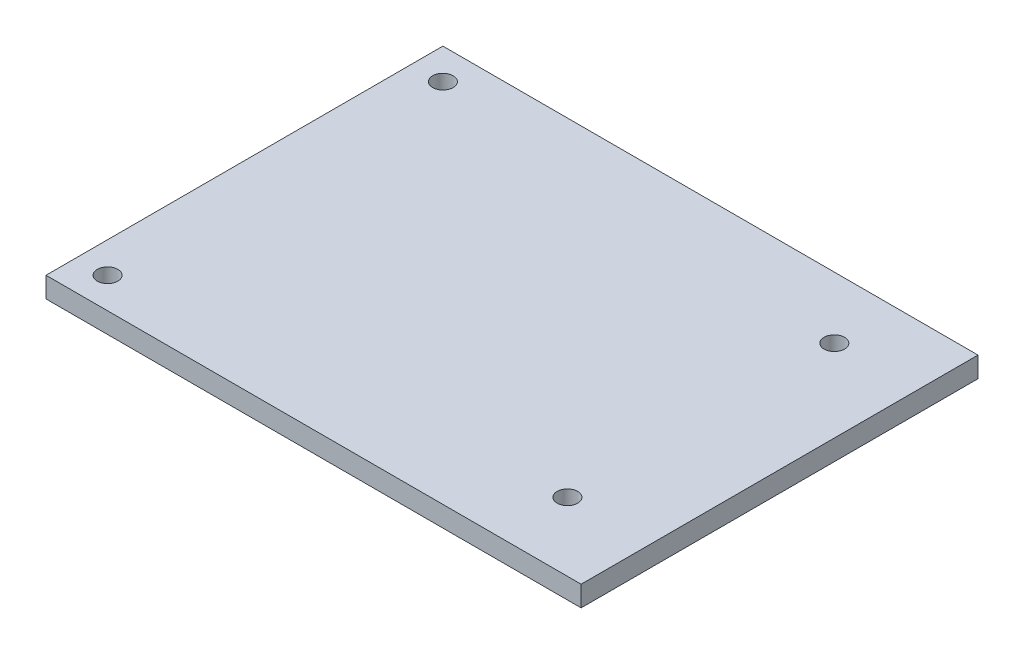
from build123d import *

# Parameters (mm, degrees)
SKETCH1_W           = 78.2
SKETCH1_H           = 58
BOSS_EXTRUDE1_DEPTH = 3
SKETCH2_R           = 1.5
CUT_EXTRUDE1_DEPTH  = 3
SKETCH3_R           = 1.5
CUT_EXTRUDE2_DEPTH  = 3


with BuildPart() as part:
    # Sketch1 → Boss-Extrude1 (new body)
    with BuildSketch(Plane(origin=(0, 0, 0), x_dir=(1, 0, 0), z_dir=(0, 1, 0))):
        Rectangle(SKETCH1_W, SKETCH1_H)
    extrude(amount=BOSS_EXTRUDE1_DEPTH)

    # Sketch2 → Cut-Extrude1 (cut)
    with BuildSketch(Plane(origin=(0, 3, 0), x_dir=(1, 0, 0), z_dir=(0, 1, 0))):
        with Locations(Location((-34.6, 24.5, 0), (0, 0, 270))):
            Circle(SKETCH2_R)
        with Locations(Location((-34.6, -24.5, 0), (0, 0, 270))):
            Circle(SKETCH2_R)
    extrude(amount=-CUT_EXTRUDE1_DEPTH, mode=Mode.SUBTRACT)

    # Sketch3 → Cut-Extrude2 (cut)
    with BuildSketch(Plane(origin=(0, 3, 0), x_dir=(1, 0, 0), z_dir=(0, 1, 0))):
        with Locations(Location((27.1, 20, 0), (0, 0, 270))):
            Circle(SKETCH3_R)
        with Locations(Location((27.1, -19, 0), (0, 0, 270))):
            Circle(SKETCH3_R)
    extrude(amount=-CUT_EXTRUDE2_DEPTH, mode=Mode.SUBTRACT)


solid = part.part
